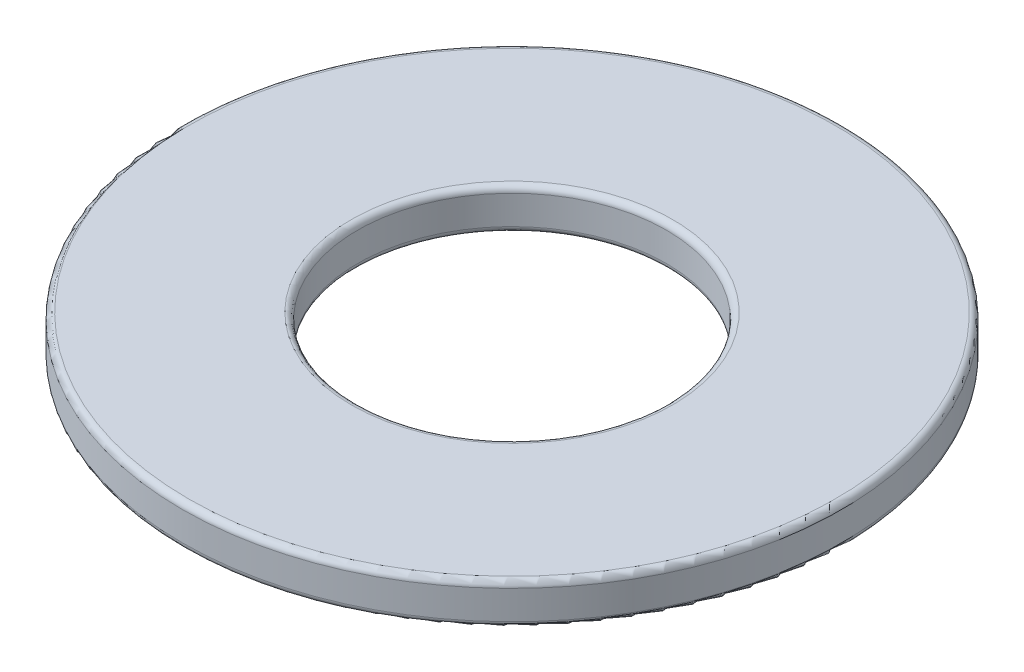
from build123d import *

# Parameters (mm, degrees)
SKETCH1_R           = 8
SKETCH1_R_2         = 3.75
BOSS_EXTRUDE1_DEPTH = 0.5
FILLET1_R           = 0.15


with BuildPart() as part:
    # Sketch1 → Boss-Extrude1 (new, symmetric)
    with BuildSketch(Plane(origin=(0, 0, 0), x_dir=(1, 0, 0), z_dir=(0, 1, 0))):
        with Locations(Location((0, 0, 0), (0, 0, 270))):
            Circle(SKETCH1_R)
        with Locations(Location((0, 0, 0), (0, 0, 270))):
            Circle(SKETCH1_R_2, mode=Mode.SUBTRACT)
    extrude(amount=BOSS_EXTRUDE1_DEPTH, both=True)

    # Fillet1
    fillet1_edges = [part.edges().sort_by_distance(p)[0] for p in [
        (0, -0.5, -8),
        (0, 0.5, -8),
        (0, -0.5, -3.75),
        (0, 0.5, -3.75),
    ]]
    fillet(fillet1_edges, radius=FILLET1_R)


solid = part.part
